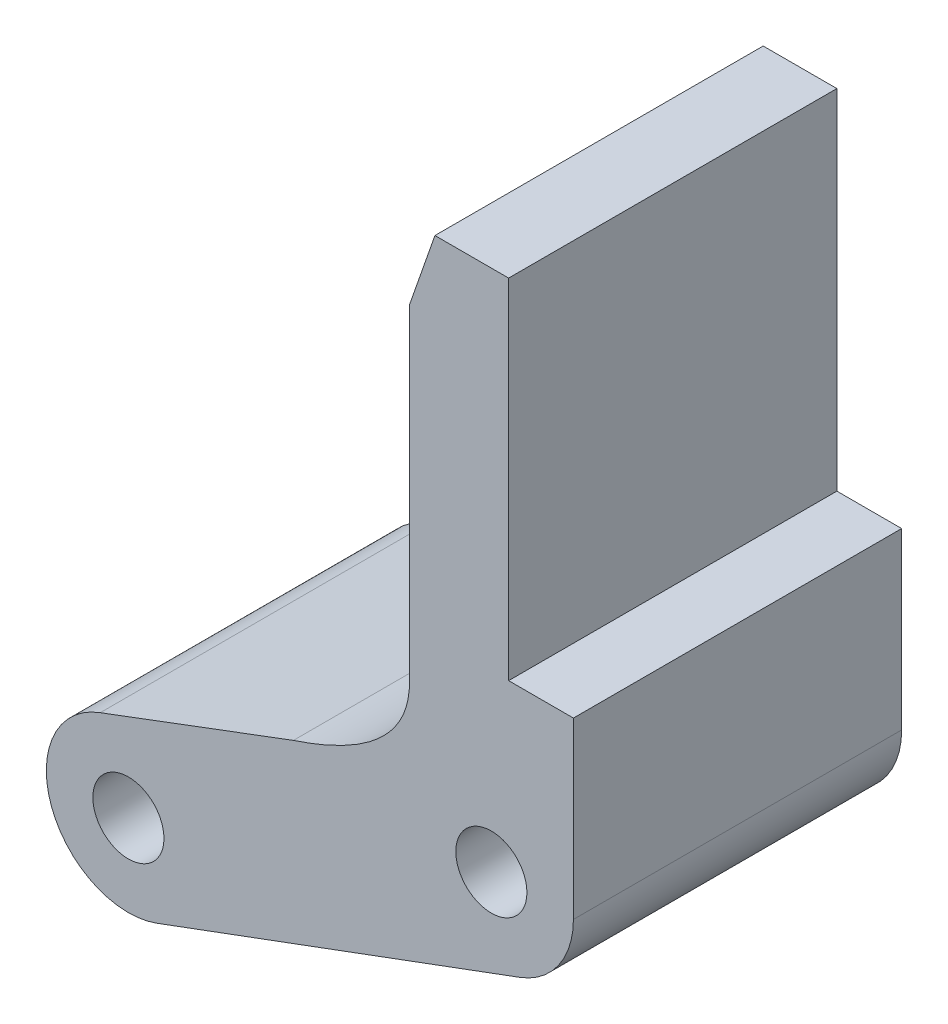
from build123d import *

# Parameters (mm, degrees)
ESQUISSE1_R        = 1.3
BOSS_EXTRU_1_DEPTH = 12


with BuildPart() as part:
    # Esquisse1 → Boss.-Extru.1 (new body)
    with BuildSketch(Plane.XY):
        with BuildLine():
            Line((159.701668195, 188.296706066), (158.766015625, 185.623295296))
            Line((158.766015625, 185.623295296), (158.766015625, 173.839174165))
            add(Edge.make_bspline(
                [(158.766015625, 173.839174165), (158.908011503, 171.16248829), (154.528686771, 169.726069)],
                knots=[0, 0, 0, 1, 1, 1], degree=2))
            Line((154.528686771, 169.726069), (147.466091463, 167.071838941))
            ThreePointArc((147.466091463, 167.071838941), (145.677207205, 163.224776021), (149.524270126, 161.435891763))
            Line((149.524270126, 161.435891763), (162.793418929, 166.356678901))
            ThreePointArc((162.793418929, 166.356678901), (164.222709959, 167.45524387), (164.764329598, 169.17465249))
            Line((164.764329598, 169.17465249), (164.764329598, 175.550568138))
            Line((164.764329598, 175.550568138), (162.39595917, 175.550568138))
            Line((162.39595917, 175.550568138), (162.39595917, 188.296706066))
            Line((162.39595917, 188.296706066), (159.701668195, 188.296706066))
        make_face()
        with Locations((148.495180794, 164.253865352)):
            Circle(ESQUISSE1_R, mode=Mode.SUBTRACT)
        with Locations((161.764329598, 169.17465249)):
            Circle(ESQUISSE1_R, mode=Mode.SUBTRACT)
    extrude(amount=BOSS_EXTRU_1_DEPTH)


solid = part.part
